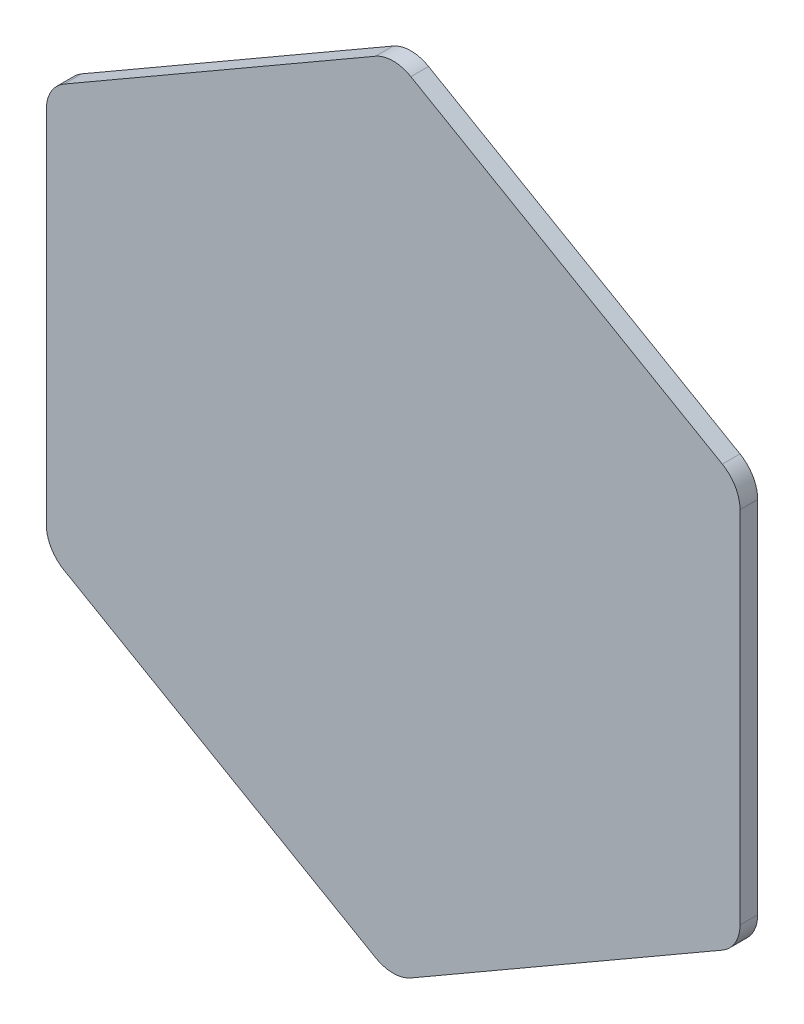
from build123d import *

# Parameters (mm, degrees)
EXTRUDE_1_DEPTH = 0.5
FILLET_1_R      = 1
EXTRUDE_3_DEPTH = 0.5


with BuildPart() as part:
    # 草图1 → 凸台-拉伸1 (new body)
    with BuildSketch(Plane.XY):
        Polygon((0, 11.32), (-9.803407571, 5.66), (-9.803407571, -5.66), (0, -11.32), (9.803407571, -5.66), (9.803407571, 5.66), align=None)
    extrude(amount=EXTRUDE_1_DEPTH)

    # 圆角1
    fillet_1_edges = [part.edges().sort_by_distance(p)[0] for p in [
        (9.803407571, 5.66, 0.25),
        (9.803407571, -5.66, 0.25),
        (0, -11.32, 0.25),
        (-9.803407571, -5.66, 0.25),
        (-9.803407571, 5.66, 0.25),
        (0, 11.32, 0.25),
    ]]
    fillet(fillet_1_edges, radius=FILLET_1_R)

    # 草图3 → 凸台-拉伸3 (add)
    with BuildSketch(Plane.XY):
        with BuildLine():
            ThreePointArc((-0.705543929, 4.595579399), (-2.307952893, 3.904221506), (-3.711787683, 2.867429289))
            Line((-3.711787683, 2.867429289), (-6.661562741, 4.026250683))
            Line((-6.661562741, 4.026250683), (-6.661562741, 6.935405958))
            Line((-6.661562741, 6.935405958), (-0.705543929, 4.595579399))
        make_face()
        with BuildLine():
            Line((4.934454899, 3.138543991), (4.934454899, 6.0297367))
            Line((4.934454899, 6.0297367), (2.059575955, 4.900778413))
            Line((2.059575955, 4.900778413), (-1.550809491, 3.48298843))
            ThreePointArc((-1.550809491, 3.48298843), (-0.972236897, -5.880889221), (4.037122418, 2.051529715))
            Line((4.037122418, 2.051529715), (1.146295729, 0.94525211))
            ThreePointArc((1.146295729, 0.94525211), (0.382149802, -3.335491783), (-0.835814603, 0.838864453))
            ThreePointArc((-0.835814603, 0.838864453), (-0.56429829, 0.968919842), (-0.277756056, 1.061272752))
            Line((-0.277756056, 1.061272752), (3.527417355, 2.577784143))
            Line((3.527417355, 2.577784143), (4.934454899, 3.138543991))
        make_face()
    extrude(amount=-EXTRUDE_3_DEPTH)


solid = part.part
